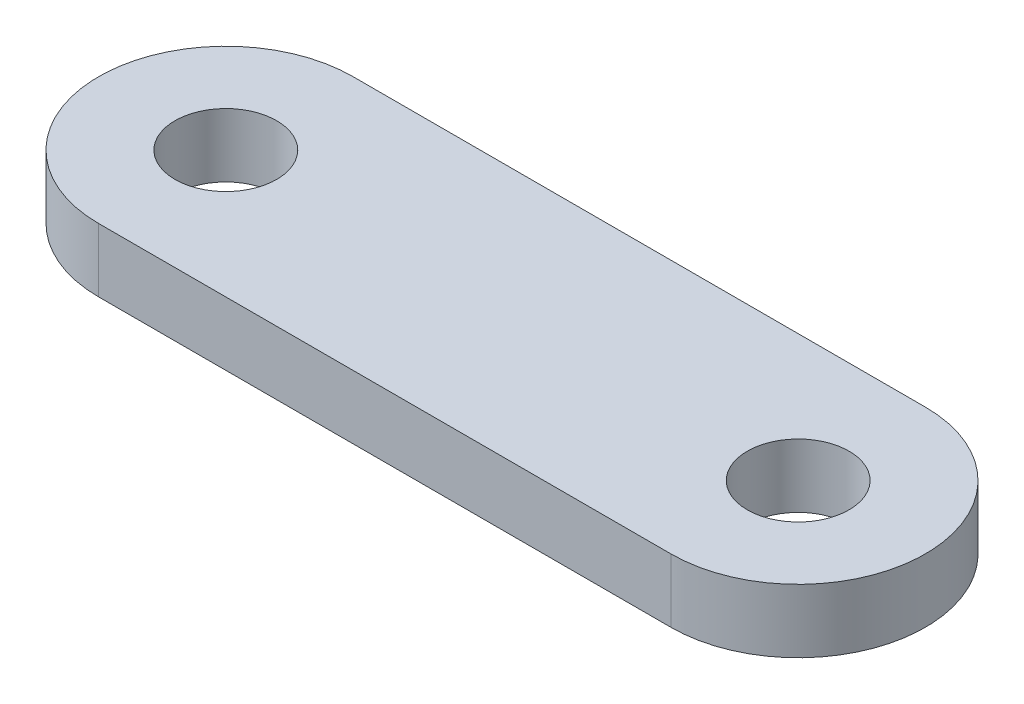
from build123d import *

# Parameters (mm, degrees)
SKETCH_1_R      = 1.6
EXTRUDE_1_DEPTH = 2


with BuildPart() as part:
    # Эскиз1 → Бобышка-Вытянуть1 (new body)
    with BuildSketch(Plane(origin=(0, 0, 0), x_dir=(1, 0, 0), z_dir=(0, 1, 0))):
        with BuildLine():
            Line((0, 0), (18, 0))
            ThreePointArc((18, 0), (22, -4), (18, -8))
            Line((18, -8), (0, -8))
            ThreePointArc((0, -8), (-4, -4), (0, 0))
        make_face()
        with Locations(Location((0, -4, 0), (0, 0, 270))):
            Circle(SKETCH_1_R, mode=Mode.SUBTRACT)
        with Locations(Location((18, -4, 0), (0, 0, 270))):
            Circle(SKETCH_1_R, mode=Mode.SUBTRACT)
    extrude(amount=EXTRUDE_1_DEPTH)


solid = part.part
